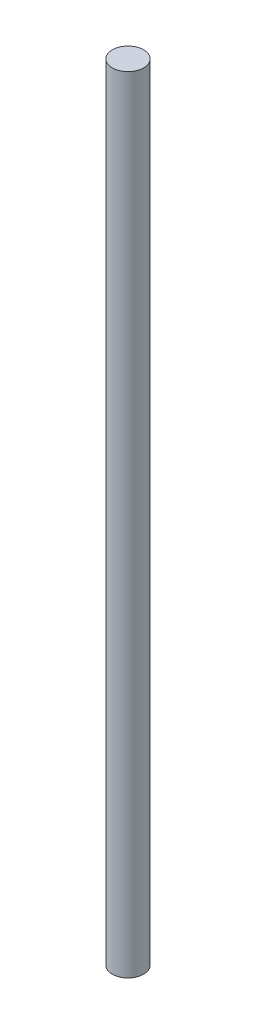
from build123d import *

# Parameters (mm, degrees)
SKETCH1_R           = 3
BOSS_EXTRUDE1_DEPTH = 150


with BuildPart() as part:
    # Sketch1 → Boss-Extrude1 (new body)
    with BuildSketch(Plane(origin=(0, 0, 0), x_dir=(1, 0, 0), z_dir=(0, 1, 0))):
        with Locations(Location((0, 0, 0), (0, 0, 270))):
            Circle(SKETCH1_R)
    extrude(amount=BOSS_EXTRUDE1_DEPTH)


solid = part.part
